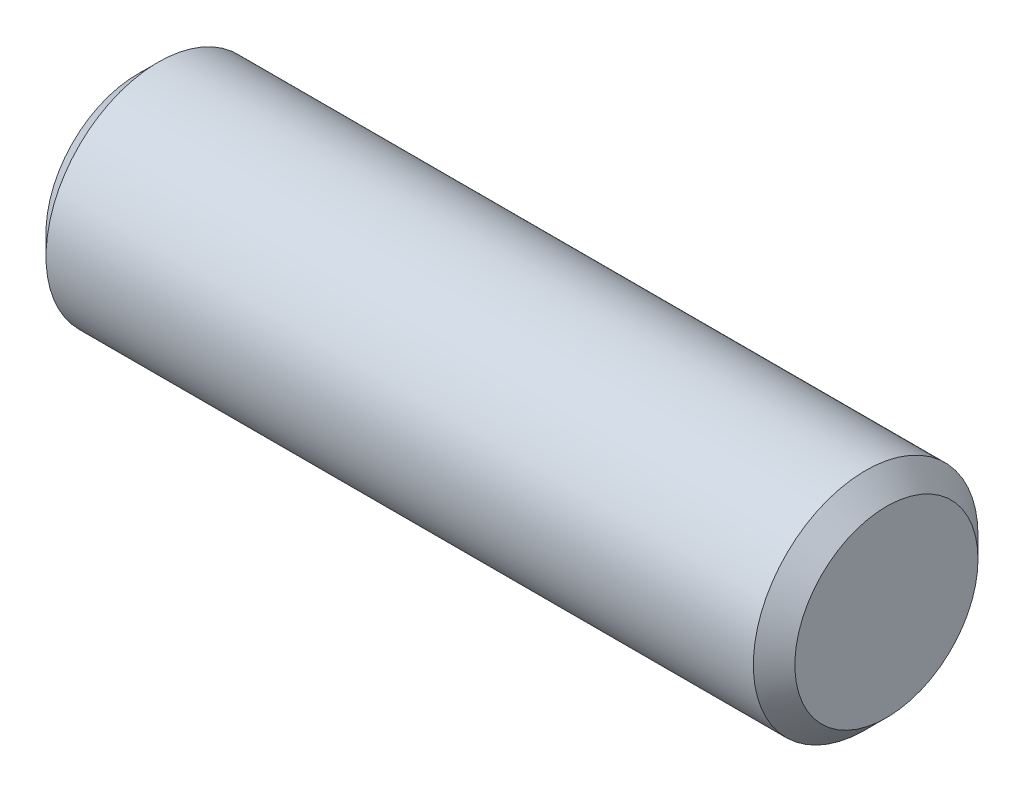
from build123d import *

# Parameters (mm, degrees)
BODYSKE_W     = 20
BODYSKE_H     = 3
CHAMFER1_SIZE = 0.5545


with BuildPart() as part:
    # BodySke → BaseBody (revolve)
    with BuildSketch(Plane.XY, mode=Mode.PRIVATE) as basebody_sk:
        with Locations((10, 1.5)):
            Rectangle(BODYSKE_W, BODYSKE_H)
    revolve(basebody_sk.sketch.rotate(Axis((-3.175, 0, 0), (1, 0, 0)), 90), axis=Axis((-3.175, 0, 0), (1, 0, 0)))

    # Chamfer1
    chamfer1_edges = [part.edges().sort_by_distance(p)[0] for p in [
        (0, 0, -3),
        (20, 0, -3),
    ]]
    chamfer(chamfer1_edges, length=CHAMFER1_SIZE)


solid = part.part
